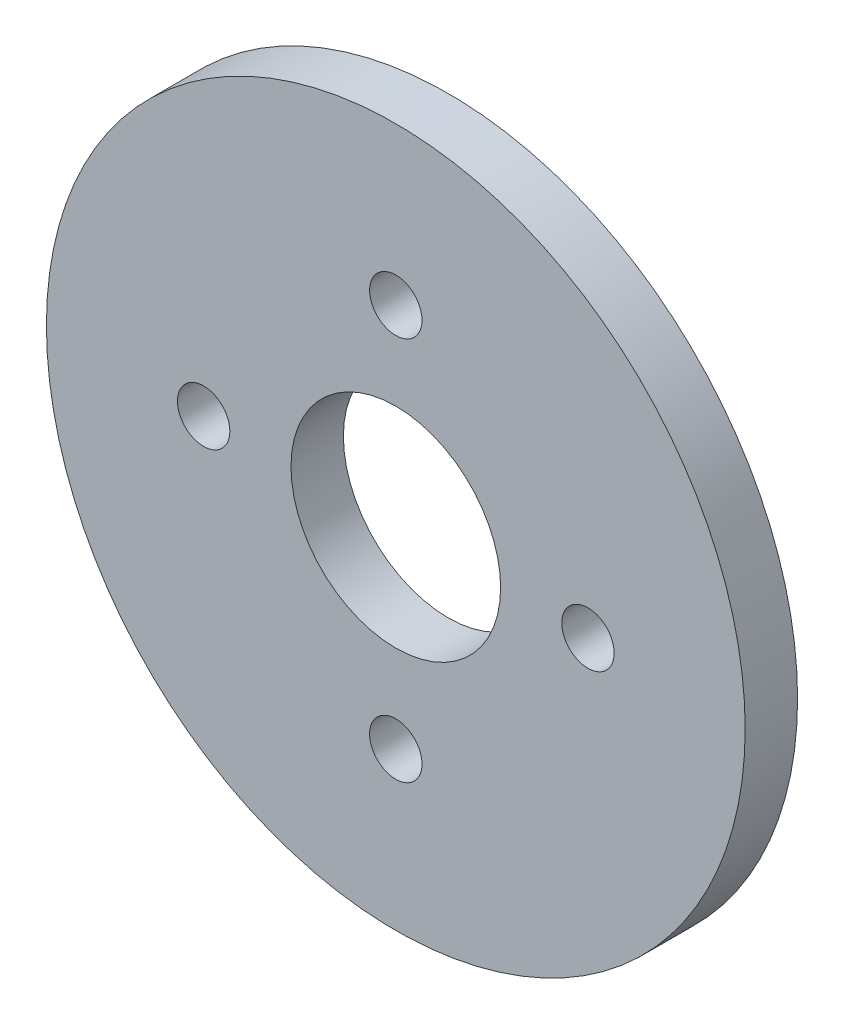
from build123d import *

# Parameters (mm, degrees)
SKETCH_1_R          = 20
SKETCH_1_R_2        = 1.5
EXTRUDE_1_DEPTH     = 3
SKETCH_2_R          = 6
CUT_EXTRUDE_1_DEPTH = 29.442925307


with BuildPart() as part:
    # 草图1 → 凸台-拉伸1 (new body)
    with BuildSketch(Plane.XY):
        Circle(SKETCH_1_R)
        with Locations((0, 11)):
            Circle(SKETCH_1_R_2, mode=Mode.SUBTRACT)
        with Locations((11, 0)):
            Circle(SKETCH_1_R_2, mode=Mode.SUBTRACT)
        with Locations((0, -11)):
            Circle(SKETCH_1_R_2, mode=Mode.SUBTRACT)
        with Locations((-11, 0)):
            Circle(SKETCH_1_R_2, mode=Mode.SUBTRACT)
    extrude(amount=EXTRUDE_1_DEPTH)

    # 草图2 → 切除-拉伸1 (cut, through all)
    with BuildSketch(Plane.XY.offset(3)):
        Circle(SKETCH_2_R)
    extrude(amount=-CUT_EXTRUDE_1_DEPTH, mode=Mode.SUBTRACT)


solid = part.part
